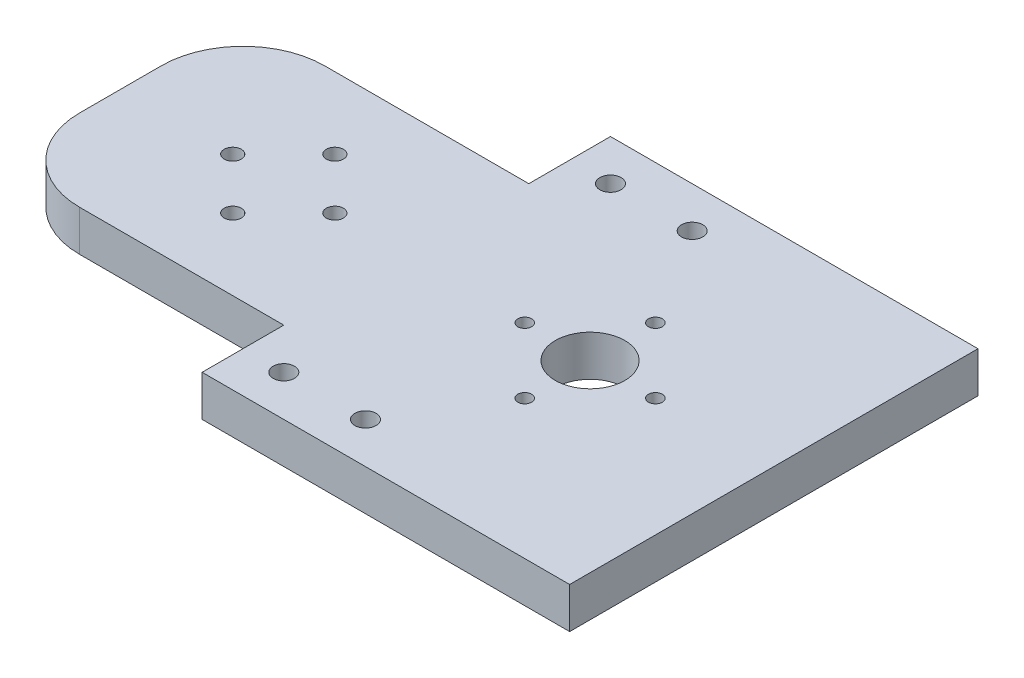
from build123d import *

# Parameters (mm, degrees)
EXTRUDE_2_DEPTH      = 10
FILLET_2_R           = 20
SKETCH_4_R           = 2.6
CUT_EXTRUDE_2_DEPTH  = 168.928556237
SKETCH_5_R           = 8.5
CUT_EXTRUDE_3_DEPTH  = 168.928556237
SKETCH_17_R          = 1.7
CUT_EXTRUDE_11_DEPTH = 10
SKETCH_18_R          = 2.1
CUT_EXTRUDE_12_DEPTH = 10


with BuildPart() as part:
    # 草图2 → 凸台-拉伸2 (new body)
    with BuildSketch(Plane(origin=(0, 0, 0), x_dir=(1, 0, 0), z_dir=(0, 1, 0))):
        Polygon((0, 50), (0, -50), (-90, -50), (-90, -30), (-160, -30), (-160, 30), (-90, 30), (-90, 50), align=None)
    extrude(amount=EXTRUDE_2_DEPTH)

    # 圆角2
    fillet_2_edges = [part.edges().sort_by_distance(p)[0] for p in [
        (-160, 5, 30),
        (-160, 5, -30),
    ]]
    fillet(fillet_2_edges, radius=FILLET_2_R)

    # 草图4 → 切除-拉伸2 (cut, through all)
    with BuildSketch(Plane(origin=(0, 10, 0), x_dir=(1, 0, 0), z_dir=(0, 1, 0))):
        with Locations(Location((-60, -40, 0), (0, 0, 270))):
            Circle(SKETCH_4_R)
        with Locations(Location((-80, -40, 0), (0, 0, 270))):
            Circle(SKETCH_4_R)
        with Locations(Location((-80, 40, 0), (0, 0, 270))):
            Circle(SKETCH_4_R)
        with Locations(Location((-60, 40, 0), (0, 0, 270))):
            Circle(SKETCH_4_R)
    extrude(amount=-CUT_EXTRUDE_2_DEPTH, mode=Mode.SUBTRACT)

    # 草图5 → 切除-拉伸3 (cut, through all)
    with BuildSketch(Plane.XZ):
        with Locations(Location((-45, 0, 0), (0, 0, 270))):
            Circle(SKETCH_5_R)
    extrude(amount=-CUT_EXTRUDE_3_DEPTH, mode=Mode.SUBTRACT)

    # 草图17 → 切除-拉伸11 (cut)
    with BuildSketch(Plane.XZ):
        with Locations(Location((-45, 16, 0), (0, 0, 270))):
            Circle(SKETCH_17_R)
        with Locations(Location((-45, -16, 0), (0, 0, 270))):
            Circle(SKETCH_17_R)
        with Locations(Location((-29, 0, 0), (0, 0, 270))):
            Circle(SKETCH_17_R)
        with Locations(Location((-61, 0, 0), (0, 0, 90))):
            Circle(SKETCH_17_R)
    extrude(amount=-CUT_EXTRUDE_11_DEPTH, mode=Mode.SUBTRACT)

    # 草图18 → 切除-拉伸12 (cut)
    with BuildSketch(Plane.XZ):
        with Locations(Location((-120, 12.5, 0), (0, 0, 270))):
            Circle(SKETCH_18_R)
        with Locations(Location((-132.5, 0, 0), (0, 0, 270))):
            Circle(SKETCH_18_R)
        with Locations(Location((-120, -12.5, 0), (0, 0, 270))):
            Circle(SKETCH_18_R)
        with Locations(Location((-107.5, 0, 0), (0, 0, 270))):
            Circle(SKETCH_18_R)
    extrude(amount=-CUT_EXTRUDE_12_DEPTH, mode=Mode.SUBTRACT)


solid = part.part
